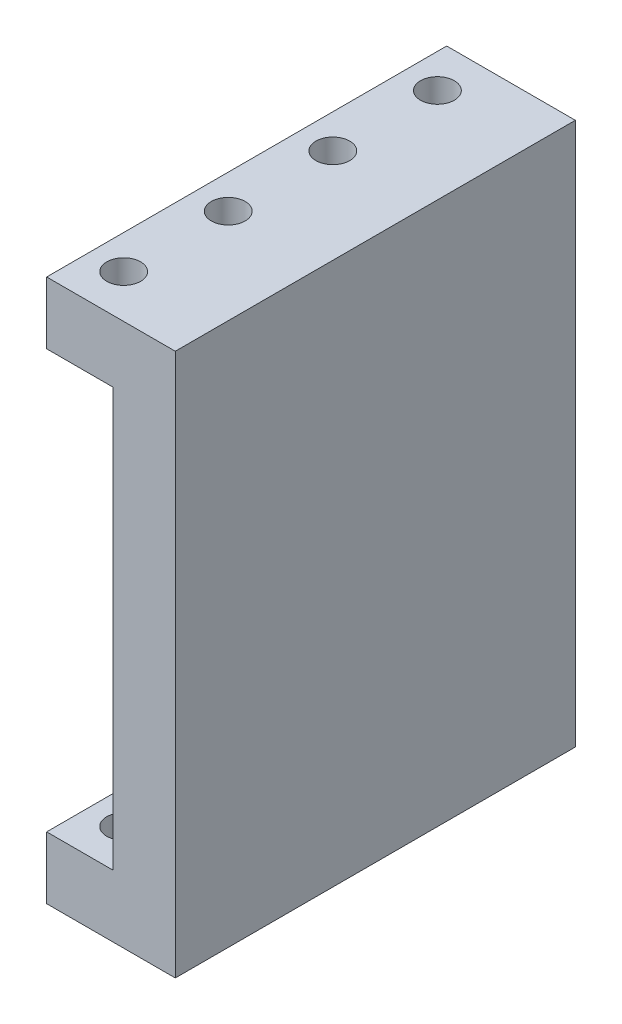
from build123d import *

# Parameters (mm, degrees)
BOSS_EXTRUDE1_DEPTH = 30.607
SKETCH2_R           = 1.2954
CUT_EXTRUDE1_DEPTH  = 52.838718059


with BuildPart() as part:
    # Sketch1 → Boss-Extrude1 (new body)
    with BuildSketch(Plane.XY):
        Polygon((-4.7625, 0), (5.08, 0), (5.08, -41.529), (-4.7625, -41.529), (-4.7625, -36.7665), (0.3175, -36.7665), (0.3175, -4.7625), (-4.7625, -4.7625), align=None)
    extrude(amount=BOSS_EXTRUDE1_DEPTH)

    # Sketch2 → Cut-Extrude1 (cut, through all)
    with BuildSketch(Plane(origin=(0, 0, 0), x_dir=(1, 0, 0), z_dir=(0, 1, 0))):
        with Locations(Location((-2.1717, -27.305, 0), (0, 0, 270))):
            Circle(SKETCH2_R)
        with Locations(Location((-2.1717, -19.304, 0), (0, 0, 270))):
            Circle(SKETCH2_R)
        with Locations(Location((-2.1717, -3.302, 0), (0, 0, 90))):
            Circle(SKETCH2_R)
        with Locations(Location((-2.1717, -11.303, 0), (0, 0, 90))):
            Circle(SKETCH2_R)
    extrude(amount=-CUT_EXTRUDE1_DEPTH, mode=Mode.SUBTRACT)


solid = part.part
